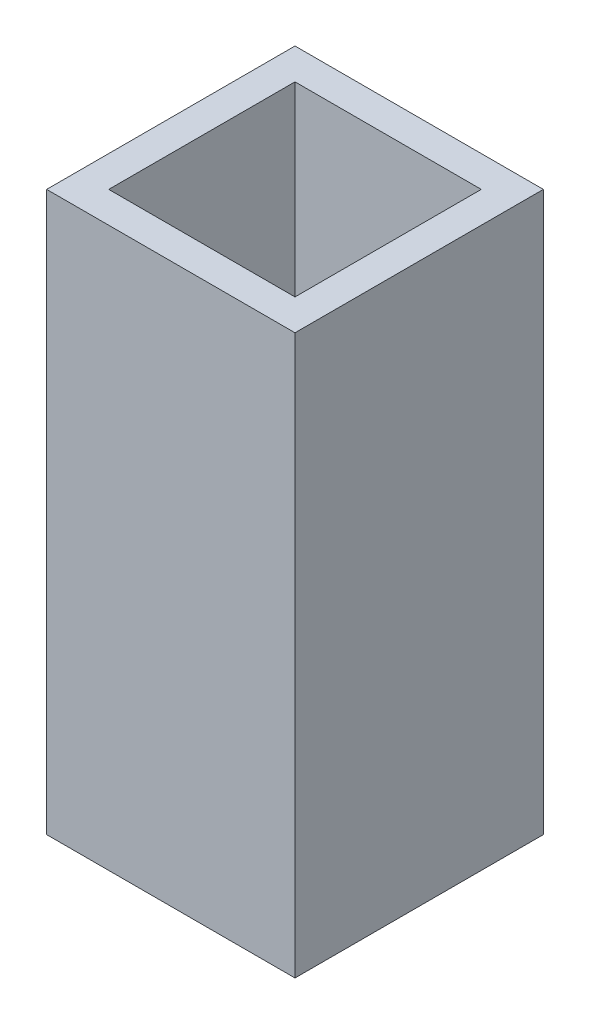
from build123d import *

# Parameters (mm, degrees)
SKETCH1_W           = 25.4
SKETCH1_H           = 25.4
SKETCH1_W_2         = 19.05
SKETCH1_H_2         = 19.05
EXTRUDE_THIN1_DEPTH = 57.15


with BuildPart() as part:
    # Sketch1 → Extrude-Thin1 (new body)
    with BuildSketch(Plane(origin=(0, 0, 0), x_dir=(1, 0, 0), z_dir=(0, 1, 0))):
        Rectangle(SKETCH1_W, SKETCH1_H)
        Rectangle(SKETCH1_W_2, SKETCH1_H_2, mode=Mode.SUBTRACT)
    extrude(amount=EXTRUDE_THIN1_DEPTH)


solid = part.part
